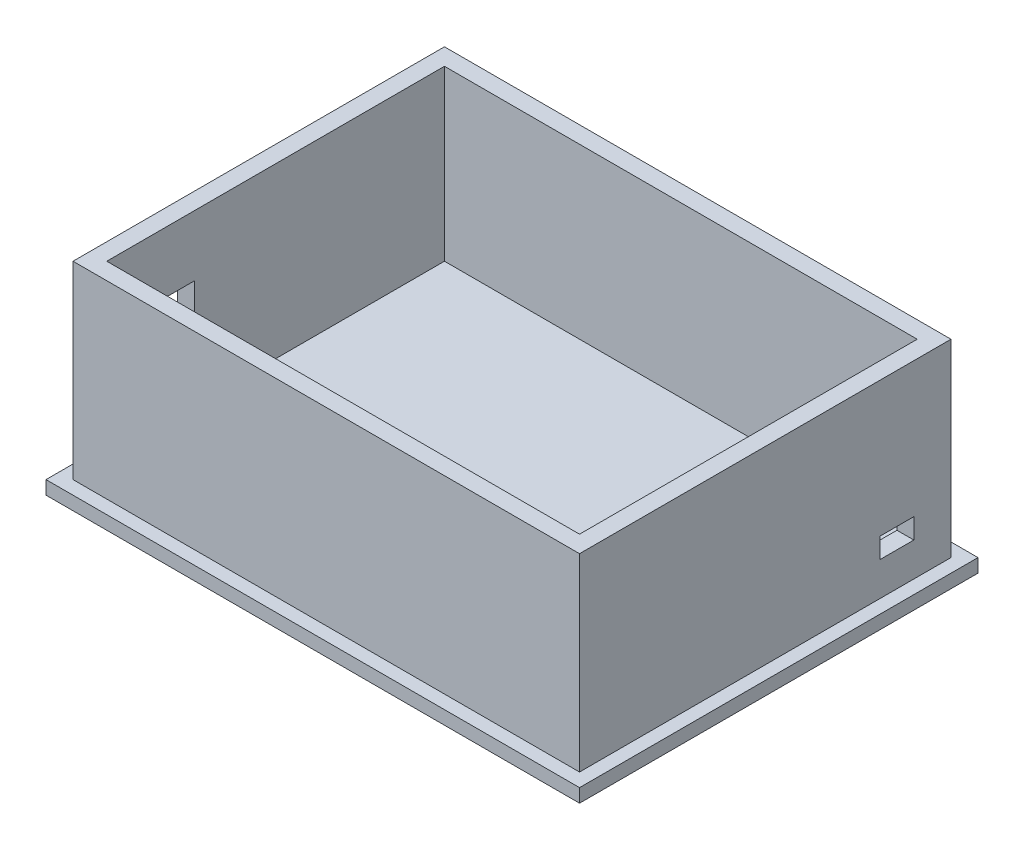
from build123d import *

# Parameters (mm, degrees)
SKETCH1_W           = 95.25
SKETCH1_H           = 69.85
BOSS_EXTRUDE1_DEPTH = 38.1
SKETCH2_W           = 88.9
SKETCH2_H           = 63.5
CUT_EXTRUDE1_DEPTH  = 31.75
CUT_EXTRUDE2_REACH  = 126.11
SKETCH3_W           = 6.35
SKETCH3_H           = 3.81
CUT_EXTRUDE3_REACH  = 126.11
SKETCH4_W           = 12.7
SKETCH4_H           = 5.08
SKETCH5_W           = 100.33
SKETCH5_H           = 74.93
BOSS_EXTRUDE2_DEPTH = 2.54


with BuildPart() as part:
    # Sketch1 → Boss-Extrude1 (new body)
    with BuildSketch(Plane(origin=(0, 0, 0), x_dir=(1, 0, 0), z_dir=(0, 1, 0))):
        with Locations((47.625, 34.925)):
            Rectangle(SKETCH1_W, SKETCH1_H)
    extrude(amount=BOSS_EXTRUDE1_DEPTH)

    # Sketch2 → Cut-Extrude1 (cut)
    with BuildSketch(Plane(origin=(0, 38.1, 0), x_dir=(1, 0, 0), z_dir=(0, 1, 0))):
        with Locations((47.625, 34.925)):
            Rectangle(SKETCH2_W, SKETCH2_H)
    extrude(amount=-CUT_EXTRUDE1_DEPTH, mode=Mode.SUBTRACT)

    # Sketch3 → Cut-Extrude2 (cut, up to next)
    with BuildSketch(Plane(origin=(95.25, 0, 0), x_dir=(0, 0, -1), z_dir=(1, 0, 0)), mode=Mode.PRIVATE) as cut_extrude2_sk1:
        with Locations((59.69, 10.795)):
            Rectangle(SKETCH3_W, SKETCH3_H)
    cut_extrude2_tool1 = extrude(cut_extrude2_sk1.sketch, amount=-CUT_EXTRUDE2_REACH, mode=Mode.PRIVATE) & part.part
    add(cut_extrude2_tool1.solids().sort_by_distance((95.25, 10.795, -59.69))[0], mode=Mode.SUBTRACT)

    # Sketch4 → Cut-Extrude3 (cut, up to next)
    with BuildSketch(Plane.ZY, mode=Mode.PRIVATE) as cut_extrude3_sk1:
        with Locations((-13.335, 24.13)):
            Rectangle(SKETCH4_W, SKETCH4_H)
    cut_extrude3_tool1 = extrude(cut_extrude3_sk1.sketch, amount=-CUT_EXTRUDE3_REACH, mode=Mode.PRIVATE) & part.part
    add(cut_extrude3_tool1.solids().sort_by_distance((0, 24.13, -13.335))[0], mode=Mode.SUBTRACT)

    # Sketch5 → Boss-Extrude2 (add)
    with BuildSketch(Plane.XZ):
        with Locations((47.625, -34.925)):
            Rectangle(SKETCH5_W, SKETCH5_H)
    extrude(amount=-BOSS_EXTRUDE2_DEPTH)


solid = part.part
